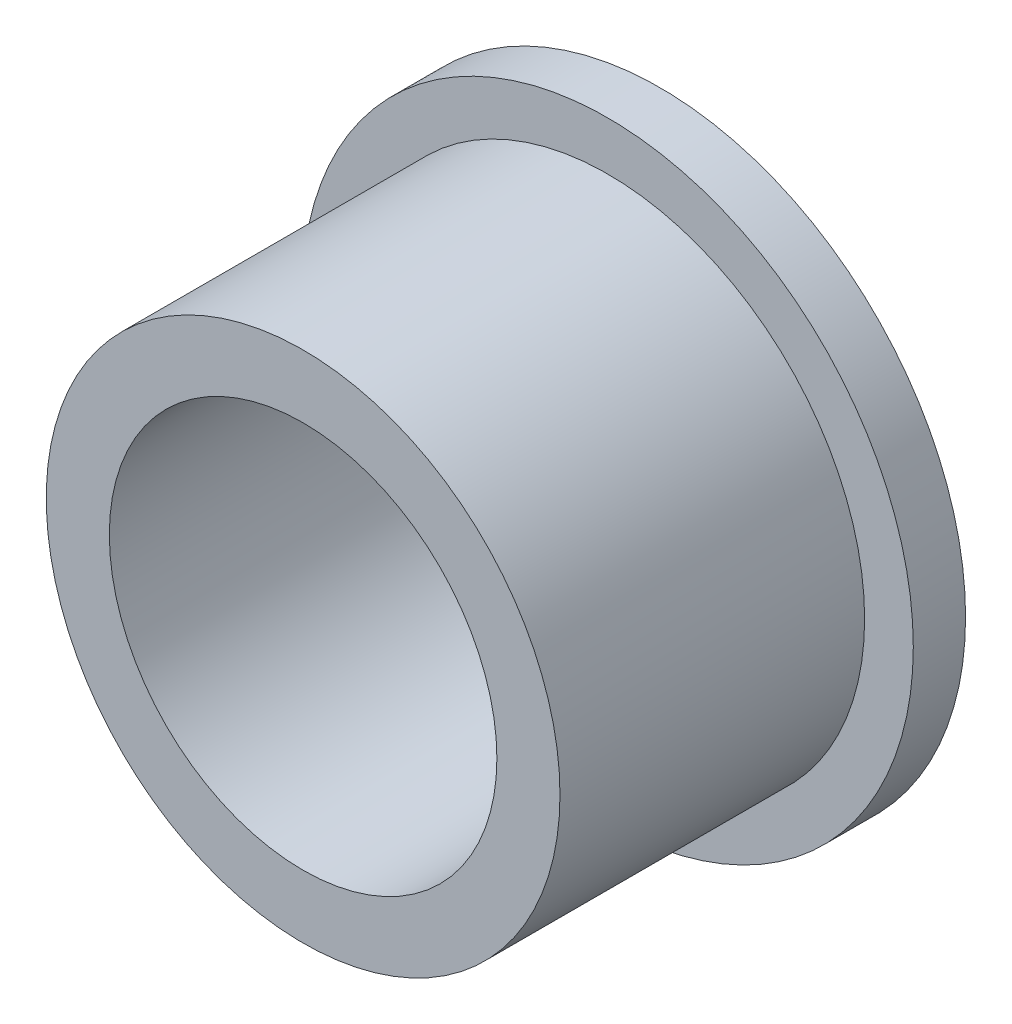
from build123d import *

# Parameters (mm, degrees)
SKETCH1_R           = 16.95
SKETCH1_R_2         = 14.25
SKETCH1_R_3         = 10.75
BOSS_EXTRUDE1_DEPTH = 2.9
SKETCH2_R           = 14.25
SKETCH2_R_2         = 10.75
BOSS_EXTRUDE2_DEPTH = 16.9


with BuildPart() as part:
    # Sketch1 → Boss-Extrude1 (new body)
    # profile 1 of 2: a face of its own
    with BuildSketch(Plane.XY):
        Circle(SKETCH1_R)
        Circle(SKETCH1_R_2, mode=Mode.SUBTRACT)
    # profile 2 of 2: a face of its own
    with BuildSketch(Plane.XY):
        Circle(SKETCH1_R_2)
        Circle(SKETCH1_R_3, mode=Mode.SUBTRACT)
    extrude(amount=BOSS_EXTRUDE1_DEPTH)

    # Sketch2 → Boss-Extrude2 (add)
    with BuildSketch(Plane.XY.offset(2.9)):
        Circle(SKETCH2_R)
        Circle(SKETCH2_R_2, mode=Mode.SUBTRACT)
    extrude(amount=BOSS_EXTRUDE2_DEPTH)


solid = part.part
